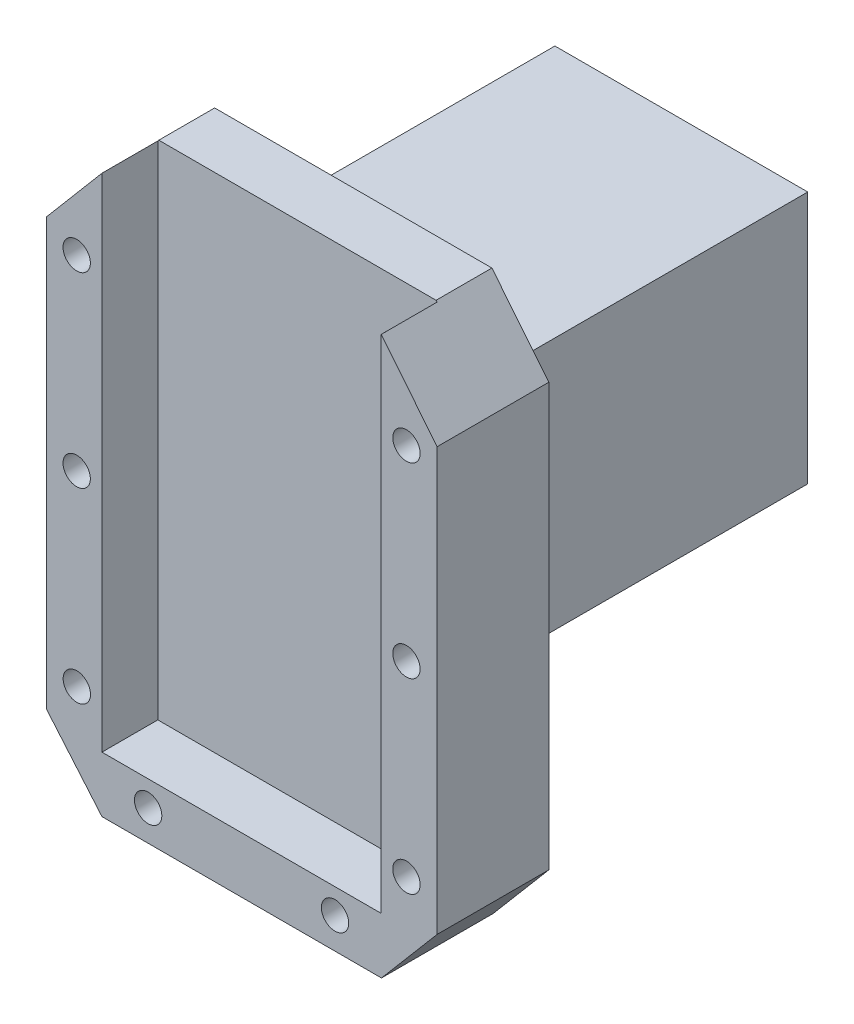
from build123d import *

# Parameters (mm, degrees)
SKETCH1_W                   = 35.56
SKETCH1_H                   = 50.8
BOSS_EXTRUDE1_DEPTH         = 10.16
SKETCH2_W                   = 25.4
SKETCH2_H                   = 45.72
CUT_EXTRUDE2_DEPTH          = 5.08
F_40_0_098_DIAMETER_HOLE1_D = 2.4892
SKETCH7_W                   = 23
SKETCH7_H                   = 23
BOSS_EXTRUDE2_DEPTH         = 30
FILLET1_R                   = 1.778
CUT_EXTRUDE3_DEPTH          = 74.878137497


with BuildPart() as part:
    # Sketch1 → Boss-Extrude1 (new body)
    with BuildSketch(Plane.XY):
        with Locations((-17.78, 25.4)):
            Rectangle(SKETCH1_W, SKETCH1_H)
    extrude(amount=BOSS_EXTRUDE1_DEPTH)

    # Sketch2 → Cut-Extrude2 (cut)
    with BuildSketch(Plane.XY.offset(10.16)):
        with Locations((-17.792594088, 27.94)):
            Rectangle(SKETCH2_W, SKETCH2_H)
    extrude(amount=-CUT_EXTRUDE2_DEPTH, mode=Mode.SUBTRACT)

    # #40 (0.098) Diameter Hole1 (through all)
    with Locations(Plane(origin=(0, 0, 0), x_dir=(-1, 0, 0), z_dir=(0, 0, -1))):
        with Locations((2.792369004, 43.087106138), (2.792369004, 26.092979092), (2.792369004, 9.105182099), (9.290740849, 2.822744672), (26.292369004, 2.787106138), (32.780032006, 9.105182099), (32.792369004, 26.087106138), (32.792369004, 43.087106138)):
            Hole(F_40_0_098_DIAMETER_HOLE1_D / 2)

    # Sketch7 → Boss-Extrude2 (add)
    with BuildSketch(Plane(origin=(0, 0, 0), x_dir=(-1, 0, 0), z_dir=(0, 0, -1))):
        with Locations((17.947498481, 29.656487967)):
            Rectangle(SKETCH7_W, SKETCH7_H)
        Polygon((15.026504795, 33.68344643), (21.026504795, 33.68344643), (24.026504795, 36.68344643), (24.026504795, 37.68344643), (21.026504795, 37.68344643), (21.026504795, 39.757316979), (28.107693687, 39.757316979), (28.107693687, 32.595354636), (26.021869747, 32.595354636), (26.026504795, 35.68344643), (25.026504795, 35.68344643), (22.026504795, 32.68344643), (22.026504795, 26.68344643), (25.026504795, 23.68344643), (26.026504795, 23.68344643), (26.026504795, 26.68344643), (28.026504795, 26.68344643), (28.026504795, 19.631136525), (21.026504795, 19.68344643), (21.026504795, 21.68344643), (24.026504795, 21.68344643), (24.026504795, 22.68344643), (21.026504795, 25.68344643), (15.026504795, 25.68344643), (12.026504795, 22.68344643), (12.026504795, 21.68344643), (15.026504795, 21.68344643), (15.026504795, 19.68344643), (7.971438759, 19.68344643), (8.026504795, 26.68344643), (10.026504795, 26.68344643), (10.026504795, 23.68344643), (11.026504795, 23.68344643), (14.026504795, 26.68344643), (14.026504795, 32.68344643), (11.026504795, 35.68344643), (10.026504795, 35.68344643), (10.026504795, 32.68344643), (8.026504795, 32.68344643), (8.026504795, 39.757316979), (15.097897728, 39.757316979), (15.026504795, 37.68344643), (12.026504795, 37.68344643), (12.026504795, 36.68344643), align=None, mode=Mode.SUBTRACT)
    extrude(amount=BOSS_EXTRUDE2_DEPTH)

    # Fillet1
    fillet1_edges = [part.edges().sort_by_distance(p)[0] for p in [
        (-6.447498481, 29.656487967, 0),
        (-17.947498481, 18.156487967, 0),
        (-29.447498481, 29.656487967, 0),
        (-17.947498481, 41.156487967, 0),
    ]]
    fillet(fillet1_edges, radius=FILLET1_R)

    # Sketch8 → Cut-Extrude3 (cut, through all)
    with BuildSketch(Plane.XY.offset(10.16)):
        Polygon((-5.178964387, 50.8), (0, 44.392134486), (0, 50.8), align=None)
        Polygon((-35.56, 44.706622517), (-35.56, 50.8), (-30.402645731, 50.8), align=None)
        Polygon((-35.56, 5.970049098), (-35.56, 0), (-30.492594088, 0), align=None)
        Polygon((-5.092594088, -0.031324356), (0, 0), (0, 5.970049098), align=None)
    extrude(amount=-CUT_EXTRUDE3_DEPTH, mode=Mode.SUBTRACT)


solid = part.part
